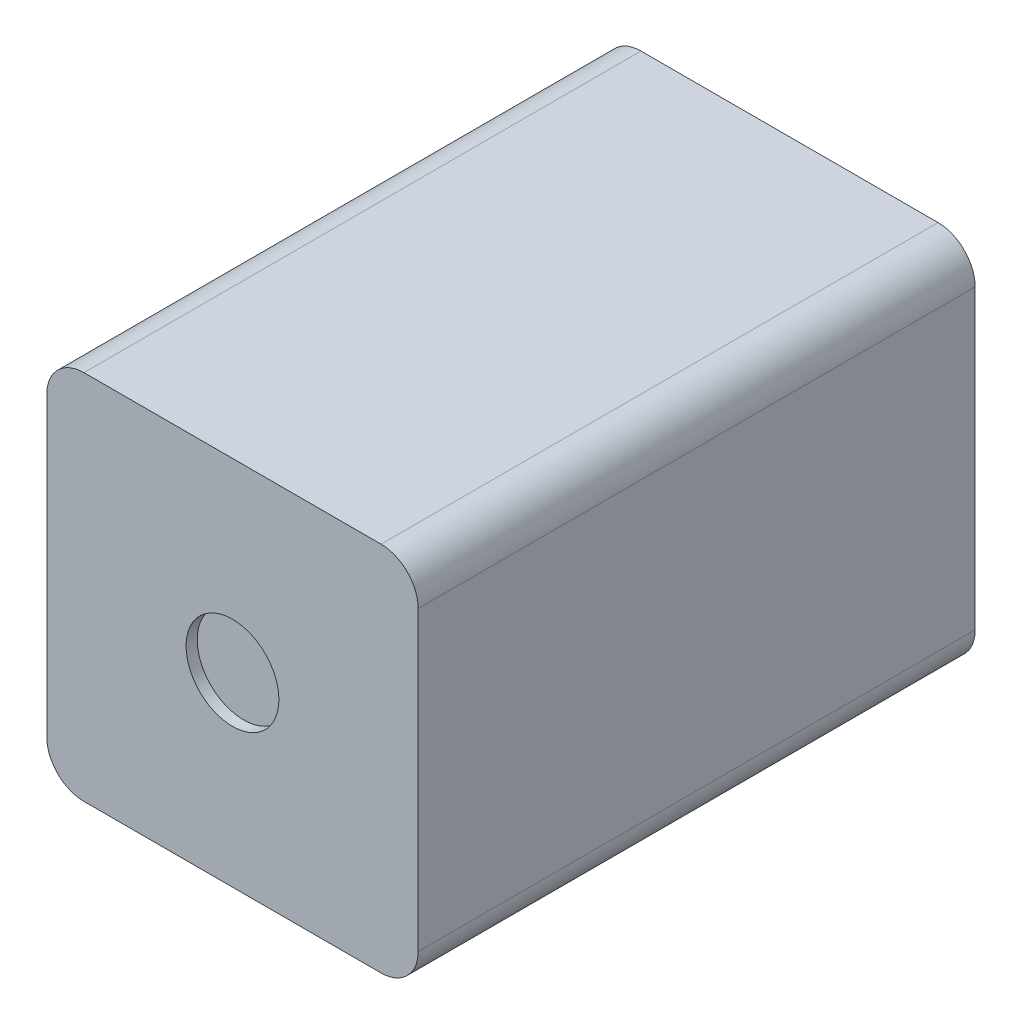
from build123d import *

# Parameters (mm, degrees)
SKETCH2_W           = 25.4
SKETCH2_H           = 25.4
BOSS_EXTRUDE1_DEPTH = 38.1
FILLET2_R           = 2.54
SKETCH4_R           = 3.175
CUT_EXTRUDE1_DEPTH  = 0.762
CUT_EXTRUDE2_START  = -0.762
SKETCH5_R           = 3.175
CUT_EXTRUDE2_DEPTH  = 0.762


with BuildPart() as part:
    # Sketch2 → Boss-Extrude1 (new body)
    with BuildSketch(Plane.XY):
        with Locations((-12.7, -12.7)):
            Rectangle(SKETCH2_W, SKETCH2_H)
    extrude(amount=BOSS_EXTRUDE1_DEPTH)

    # Fillet2
    fillet2_edges = [part.edges().sort_by_distance(p)[0] for p in [
        (0, -25.4, 19.05),
        (-25.4, -25.4, 19.05),
        (-25.4, 0, 19.05),
        (0, 0, 19.05),
    ]]
    fillet(fillet2_edges, radius=FILLET2_R)

    # Sketch4 → Cut-Extrude1 (cut)
    with BuildSketch(Plane.XY.offset(38.1)):
        with Locations((-12.7, -12.7)):
            Circle(SKETCH4_R)
    extrude(amount=-CUT_EXTRUDE1_DEPTH, mode=Mode.SUBTRACT)

    # Sketch5 → Cut-Extrude2 (cut)
    with BuildSketch(Plane(origin=(0, 0, 0), x_dir=(-1, 0, 0), z_dir=(0, 0, -1)).offset(CUT_EXTRUDE2_START)):
        with Locations(Location((12.7, -12.7, 0), (0, 0, 180))):
            Circle(SKETCH5_R)
    extrude(amount=CUT_EXTRUDE2_DEPTH, mode=Mode.SUBTRACT)


solid = part.part
